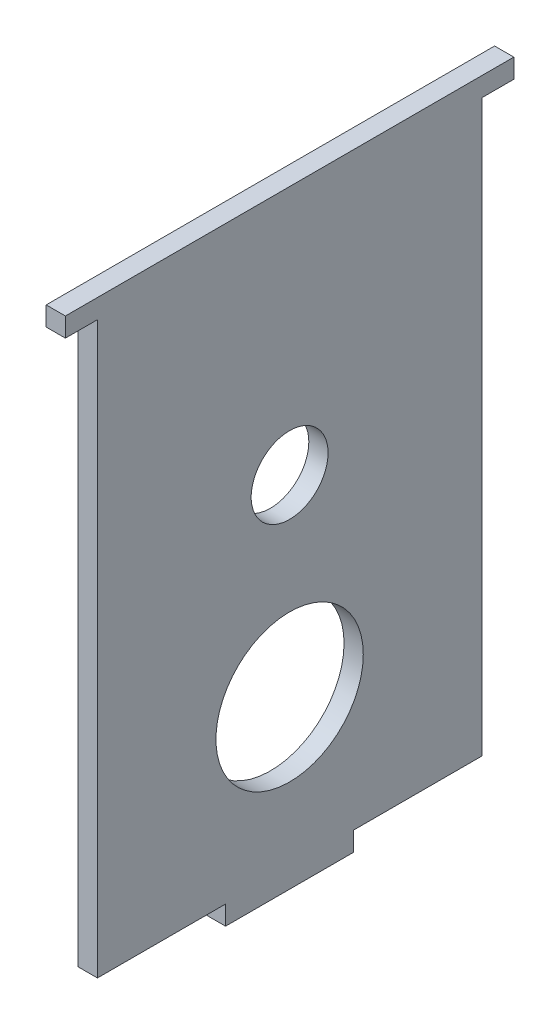
from build123d import *

# Parameters (mm, degrees)
SKETCH1_W           = 60
SKETCH1_H           = 96
BOSS_EXTRUDE1_DEPTH = 3
SKETCH2_R           = 11.5
SKETCH2_R_2         = 6
CUT_EXTRUDE1_DEPTH  = 3
SKETCH3_W           = 5
SKETCH3_H           = 3
SKETCH3_W_2         = 20
BOSS_EXTRUDE2_DEPTH = 3
SKETCH6_W           = 60
SKETCH6_H           = 4
CUT_EXTRUDE2_DEPTH  = 10


with BuildPart() as part:
    # Sketch1 → Boss-Extrude1 (new body)
    with BuildSketch(Plane(origin=(0, 0, 0), x_dir=(0, 0, -1), z_dir=(1, 0, 0))):
        Rectangle(SKETCH1_W, SKETCH1_H)
    extrude(amount=BOSS_EXTRUDE1_DEPTH)

    # Sketch2 → Cut-Extrude1 (cut)
    with BuildSketch(Plane(origin=(3, 0, 0), x_dir=(0, 0, -1), z_dir=(1, 0, 0))):
        with Locations((0, -25)):
            Circle(SKETCH2_R)
        with Locations((0, 5)):
            Circle(SKETCH2_R_2)
    extrude(amount=-CUT_EXTRUDE1_DEPTH, mode=Mode.SUBTRACT)

    # Sketch3 → Boss-Extrude2 (add)
    with BuildSketch(Plane(origin=(0, 0, 0), x_dir=(0, 0, -1), z_dir=(1, 0, 0))):
        with Locations((-32.5, 42.5)):
            Rectangle(SKETCH3_W, SKETCH3_H)
        with Locations((32.5, 42.5)):
            Rectangle(SKETCH3_W, SKETCH3_H)
        with Locations((0, -49.5)):
            Rectangle(SKETCH3_W_2, SKETCH3_H)
    extrude(amount=BOSS_EXTRUDE2_DEPTH)

    # Sketch6 → Cut-Extrude2 (cut)
    with BuildSketch(Plane(origin=(3, 0, 0), x_dir=(0, 0, -1), z_dir=(1, 0, 0))):
        with Locations((0, 46)):
            Rectangle(SKETCH6_W, SKETCH6_H)
    extrude(amount=-CUT_EXTRUDE2_DEPTH, mode=Mode.SUBTRACT)


solid = part.part
